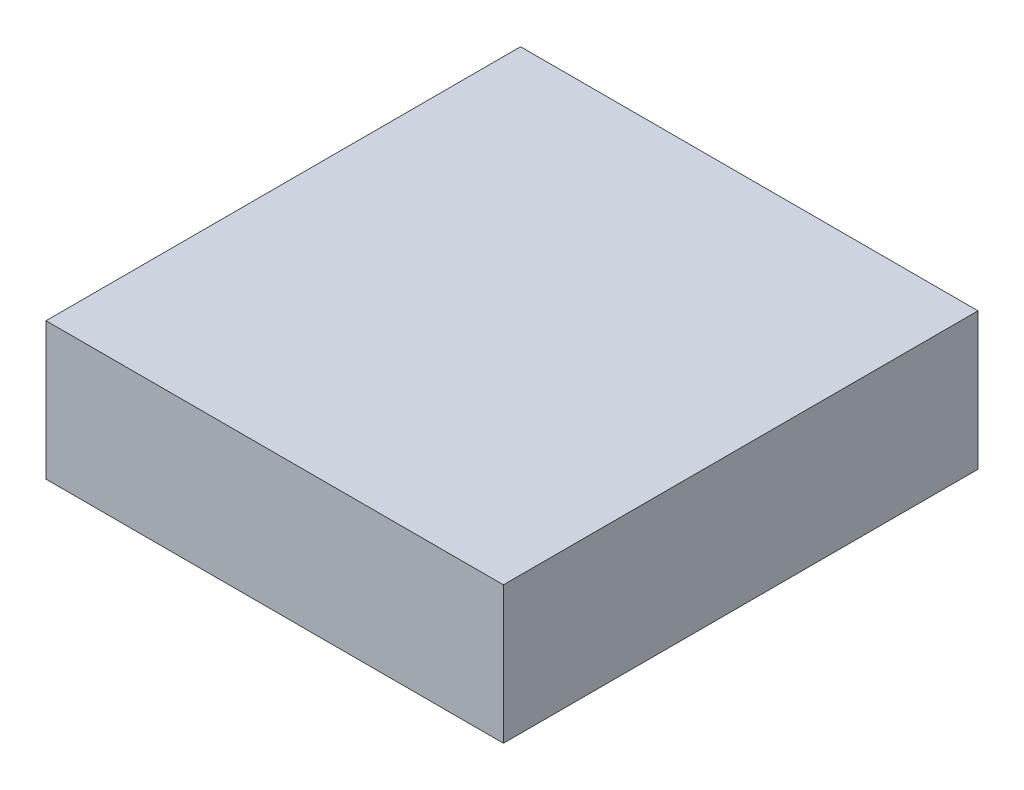
from build123d import *

# Parameters (mm, degrees)
SKETCH1_W           = 1.6
SKETCH1_H           = 1.66
BOSS_EXTRUDE1_DEPTH = 0.48


with BuildPart() as part:
    # Sketch1 → Boss-Extrude1 (new body)
    with BuildSketch(Plane(origin=(0, 0, 0), x_dir=(1, 0, 0), z_dir=(0, 1, 0))):
        Rectangle(SKETCH1_W, SKETCH1_H)
    extrude(amount=BOSS_EXTRUDE1_DEPTH)


solid = part.part
